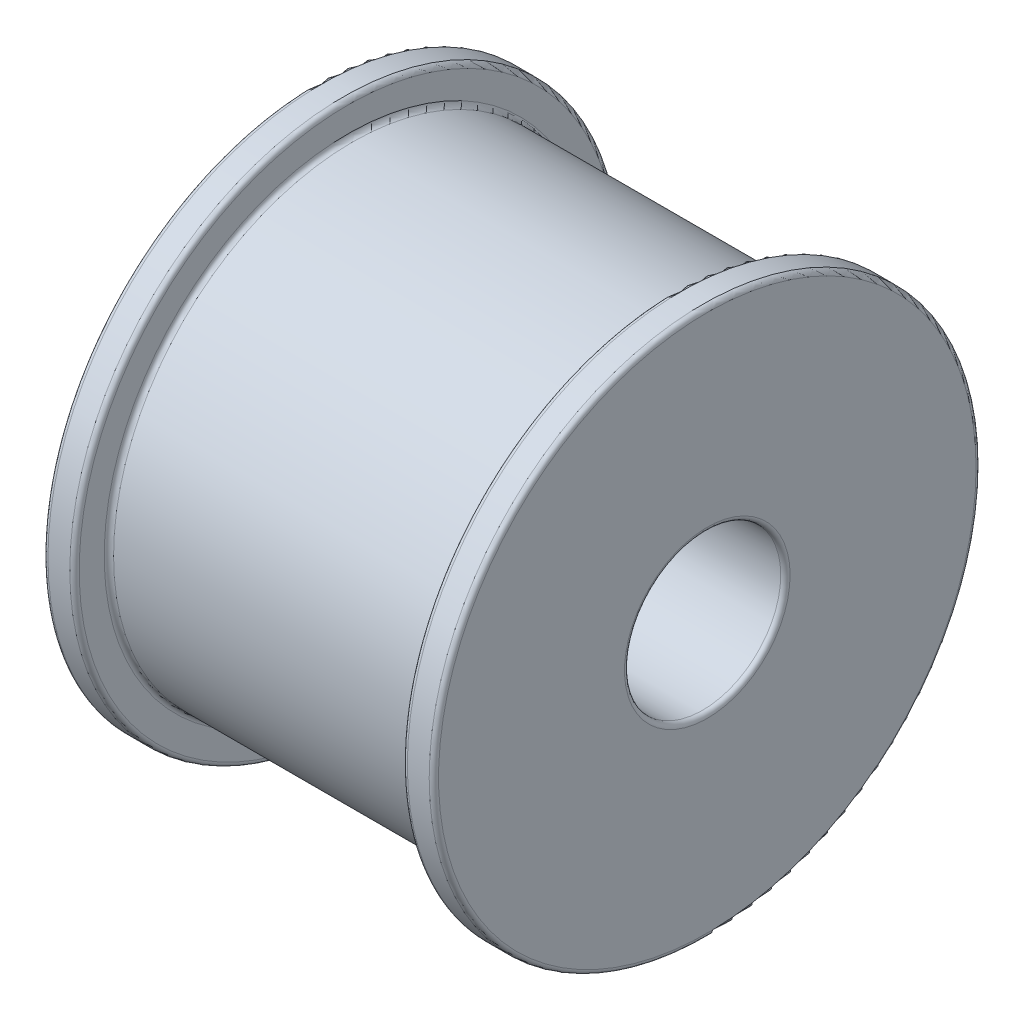
from build123d import *

# Parameters (mm, degrees)
SKETCH_1_R          = 17.5
EXTRUDE_1_DEPTH     = 2
SKETCH_2_R          = 15.3
EXTRUDE_2_DEPTH     = 21
SKETCH_3_R          = 17.5
EXTRUDE_3_DEPTH     = 2
SKETCH_4_R          = 5
CUT_EXTRUDE_1_DEPTH = 36.178118199
FILLET_1_R          = 0.3


with BuildPart() as part:
    # 草图1 → 凸台-拉伸1 (new body)
    with BuildSketch(Plane(origin=(0, 0, 0), x_dir=(0, 0, -1), z_dir=(1, 0, 0))):
        Circle(SKETCH_1_R)
    extrude(amount=EXTRUDE_1_DEPTH)

    # 草图2 → 凸台-拉伸2 (add)
    with BuildSketch(Plane(origin=(2, 0, 0), x_dir=(0, 0, -1), z_dir=(1, 0, 0))):
        with Locations(Location((0, 0, 0), (0, 0, 180))):
            Circle(SKETCH_2_R)
    extrude(amount=EXTRUDE_2_DEPTH)

    # 草图3 → 凸台-拉伸3 (add)
    with BuildSketch(Plane(origin=(23, 0, 0), x_dir=(0, 0, -1), z_dir=(1, 0, 0))):
        Circle(SKETCH_3_R)
    extrude(amount=EXTRUDE_3_DEPTH)

    # 草图4 → 切除-拉伸1 (cut, through all)
    with BuildSketch(Plane(origin=(25, 0, 0), x_dir=(0, 0, -1), z_dir=(1, 0, 0))):
        Circle(SKETCH_4_R)
    extrude(amount=-CUT_EXTRUDE_1_DEPTH, mode=Mode.SUBTRACT)

    # 圆角1
    fillet_1_edges = [part.edges().sort_by_distance(p)[0] for p in [
        (25, 0, 17.5),
        (0, 0, 5),
        (25, 0, 5),
        (0, 0, 17.5),
        (2, 0, 17.5),
        (2, 0, -15.3),
        (23, 0, -15.3),
        (23, 0, 17.5),
    ]]
    fillet(fillet_1_edges, radius=FILLET_1_R)


solid = part.part
